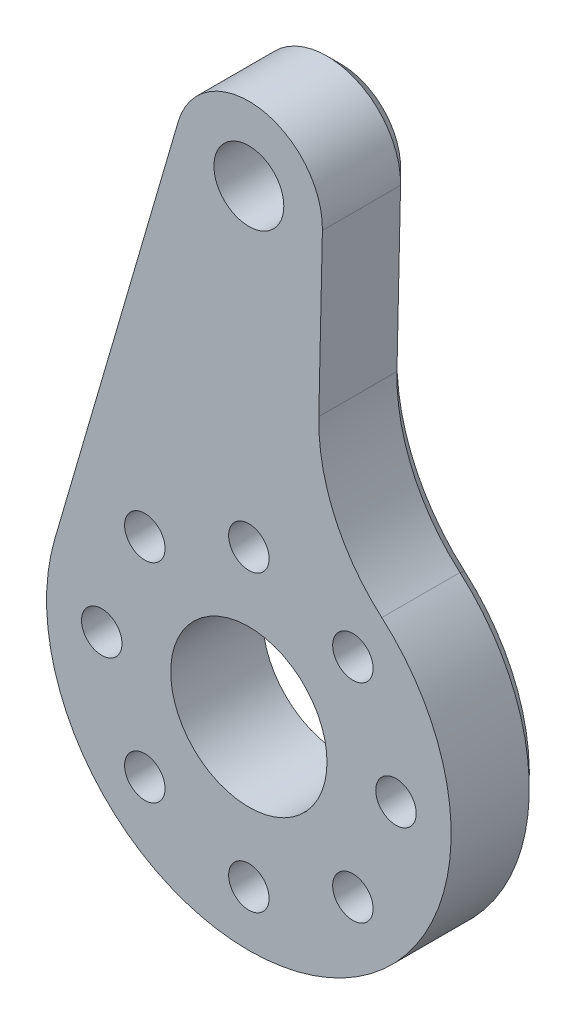
from build123d import *
from build123d.topology import SkipClean

# Parameters (mm, degrees)
SKETCH1_R             = 1.9
SKETCH1_R_2           = 4.25
SKETCH1_R_3           = 1.1
BOSS_EXTRUDE1_DEPTH   = 5
SKETCH4_R             = 1.75
CUT_EXTRUDE3_DEPTH    = 2.25
CORTAR_EXTRUIR1_DEPTH = 10
REDONDEO1_R           = 10
CHAFL_N1_SIZE         = 0.75


with BuildPart() as part:
    # Sketch1 → Boss-Extrude1 (new body)
    with BuildSketch(Plane.XY):
        with BuildLine():
            Line((-18.558111277, 4.616096398), (-25.278111277, -18.423903602))
            ThreePointArc((-25.278111277, -18.423903602), (-14.718111277, -32.503903602), (-4.158111277, -18.423903602))
            Line((-4.158111277, -18.423903602), (-10.878111277, 4.616096398))
            ThreePointArc((-10.878111277, 4.616096398), (-14.718111277, 7.496096398), (-18.558111277, 4.616096398))
        make_face()
        with Locations((-14.718111277, 3.496096398)):
            Circle(SKETCH1_R, mode=Mode.SUBTRACT)
        with Locations((-14.718111277, -21.503903602)):
            Circle(SKETCH1_R_2, mode=Mode.SUBTRACT)
        with Locations((-6.718111277, -21.503903602)):
            Circle(SKETCH1_R_3, mode=Mode.SUBTRACT)
        with Locations((-9.061257027, -27.160757851)):
            Circle(SKETCH1_R_3, mode=Mode.SUBTRACT)
        with Locations((-14.718111277, -29.503903602)):
            Circle(SKETCH1_R_3, mode=Mode.SUBTRACT)
        with Locations((-20.374965526, -27.160757851)):
            Circle(SKETCH1_R_3, mode=Mode.SUBTRACT)
        with Locations((-22.718111277, -21.503903602)):
            Circle(SKETCH1_R_3, mode=Mode.SUBTRACT)
        with Locations((-20.374965526, -15.847049352)):
            Circle(SKETCH1_R_3, mode=Mode.SUBTRACT)
        with Locations((-14.718111277, -13.503903602)):
            Circle(SKETCH1_R_3, mode=Mode.SUBTRACT)
        with Locations((-9.061257027, -15.847049352)):
            Circle(SKETCH1_R_3, mode=Mode.SUBTRACT)
    extrude(amount=BOSS_EXTRUDE1_DEPTH)

    # Sketch4 → Cut-Extrude3 (cut)
    with BuildSketch(Plane(origin=(0, 0, 0), x_dir=(-1, 0, 0), z_dir=(0, 0, -1))):
        with Locations((22.718111277, -21.503903602)):
            Circle(SKETCH4_R)
        with Locations((20.374965526, -27.160757851)):
            Circle(SKETCH4_R)
        with Locations((14.718111277, -29.503903602)):
            Circle(SKETCH4_R)
        with Locations((9.061257027, -27.160757851)):
            Circle(SKETCH4_R)
        with Locations((6.718111277, -21.503903602)):
            Circle(SKETCH4_R)
        with Locations((9.061257027, -15.847049352)):
            Circle(SKETCH4_R)
        with Locations((14.718111277, -13.503903602)):
            Circle(SKETCH4_R)
        with Locations((20.374965526, -15.847049352)):
            Circle(SKETCH4_R)
    extrude(amount=-CUT_EXTRUDE3_DEPTH, mode=Mode.SUBTRACT)

    # Croquis1 → Cortar-Extruir1 (cut)
    with SkipClean():  # the faces are left unmerged after this step: merging them gives an invalid solid
        with BuildSketch(Plane(origin=(0, 0, 0), x_dir=(-1, 0, 0), z_dir=(0, 0, -1))):
            with BuildLine():
                Line((10.719078773, 3.408124606), (11.039054977, -11.13739287))
                ThreePointArc((11.039054977, -11.13739287), (6.720549727, -13.951486157), (4.158111277, -18.423903602))
                Line((4.158111277, -18.423903602), (10.878111277, 4.616096398))
                ThreePointArc((10.878111277, 4.616096398), (10.752331831, 4.018201167), (10.719078773, 3.408124606))
            make_face()
        extrude(amount=-CORTAR_EXTRUIR1_DEPTH, mode=Mode.SUBTRACT)

    # Redondeo1
    redondeo1_edges = [part.edges().sort_by_distance(p)[0] for p in [
        (-11.039054977, -11.13739287, 2.5),
    ]]
    fillet(redondeo1_edges, radius=REDONDEO1_R)

    # Chaflán1
    chafl_n1_edges = [part.edges().sort_by_distance(p)[0] for p in [
        (-10.816579688, -1.024083907, 0),
        (-10.06427699, -9.715796647, 0),
        (-14.718111277, -32.503903602, 0),
        (-21.918111277, -6.903903602, 0),
        (-14.718111277, 7.496096398, 0),
    ]]
    chamfer(chafl_n1_edges, length=CHAFL_N1_SIZE)


solid = part.part
